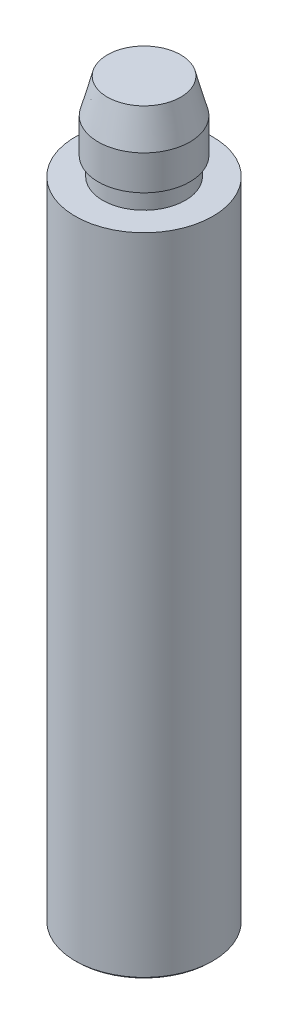
from build123d import *

# Parameters (mm, degrees)
HOLE_WIZARD_M6_1_D     = 5
HOLE_WIZARD_M6_1_DEPTH = 15
HOLE_WIZARD_M6_1_TIP   = 1.502151548
CHAMFER_1_SIZE         = 0.2


with BuildPart() as part:
    # 草图1 → 旋转1 (revolve)
    with BuildSketch(Plane.XY):
        Polygon((0, 0), (7.5, 0), (7.5, 70.5), (4.5, 70.5), (4.5, 72.5), (5, 72.5), (5, 76.267949192), (4, 80), (0, 80), align=None)
    revolve(axis=Axis((0, -1000, 0), (0, 1, 0)))

    # M6 螺纹孔1
    with Locations(Plane(origin=(0, 0, 0), x_dir=(-1, 0, 0), z_dir=(0, -1, 0))):
        with Locations((0, 0)):
            Hole(HOLE_WIZARD_M6_1_D / 2, depth=HOLE_WIZARD_M6_1_DEPTH)
            with Locations((0, 0, -(HOLE_WIZARD_M6_1_DEPTH + HOLE_WIZARD_M6_1_TIP / 2))):  # 118° drill point
                Cone(0, HOLE_WIZARD_M6_1_D / 2, HOLE_WIZARD_M6_1_TIP, mode=Mode.SUBTRACT)

    # 倒角1
    chamfer_1_edges = [part.edges().sort_by_distance(p)[0] for p in [
        (-7.5, 0, 0),
    ]]
    chamfer(chamfer_1_edges, length=CHAMFER_1_SIZE)


solid = part.part
